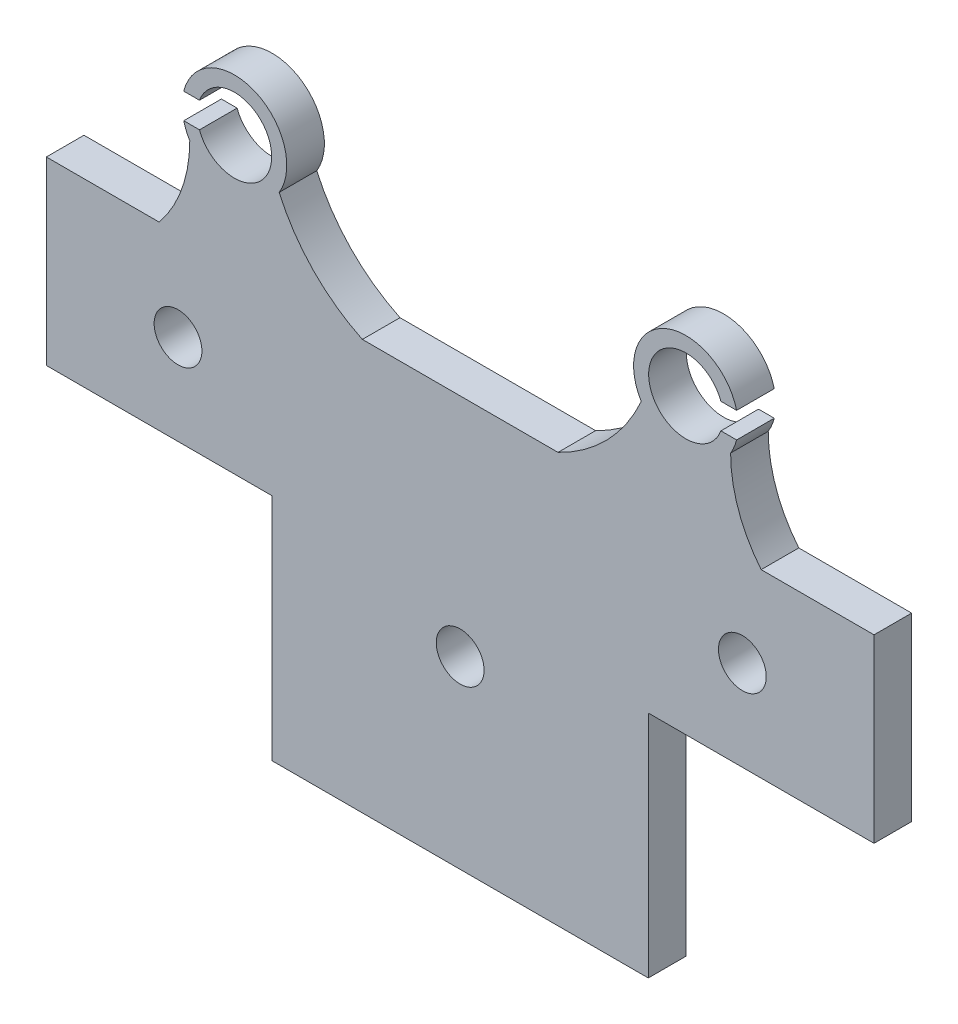
from build123d import *

# Parameters (mm, degrees)
CROQUIS1_R              = 4.95
CROQUIS1_R_2            = 3.175
SALIENTE_EXTRUIR1_DEPTH = 5
CORTAR_EXTRUIR1_DEPTH   = 78.590270009


with BuildPart() as part:
    # Croquis1 → Saliente-Extruir1 (new body)
    with BuildSketch(Plane.XY):
        with BuildLine():
            Line((13, 0), (-13, 0))
            ThreePointArc((-13, 0), (-19.544656296, 4.709966775), (-24.061489507, 11.389377737))
            ThreePointArc((-24.061489507, 11.389377737), (-30, 21.95), (-35.938510493, 11.389377737))
            ThreePointArc((-35.938510493, 11.389377737), (-36.984260452, 5.34343649), (-40, 0))
            Line((-40, 0), (-55, 0))
            Line((-55, 0), (-55, -24))
            Line((-55, -24), (-25, -24))
            Line((-25, -24), (-25, -54.5))
            Line((-25, -54.5), (25, -54.5))
            Line((25, -54.5), (25, -24))
            Line((25, -24), (55, -24))
            Line((55, -24), (55, 0))
            Line((55, 0), (40, 0))
            ThreePointArc((40, 0), (36.984260452, 5.34343649), (35.938510493, 11.389377737))
            ThreePointArc((35.938510493, 11.389377737), (30, 21.95), (24.061489507, 11.389377737))
            ThreePointArc((24.061489507, 11.389377737), (19.544656296, 4.709966775), (13, 0))
        make_face()
        with Locations((-30, 15)):
            Circle(CROQUIS1_R, mode=Mode.SUBTRACT)
        with Locations((-37.5, -12)):
            Circle(CROQUIS1_R_2, mode=Mode.SUBTRACT)
        with Locations((0, -30)):
            Circle(CROQUIS1_R_2, mode=Mode.SUBTRACT)
        with Locations(Location((30, 15, 0), (0, 0, 180))):
            Circle(CROQUIS1_R, mode=Mode.SUBTRACT)
        with Locations(Location((37.5, -12, 0), (0, 0, 180))):
            Circle(CROQUIS1_R_2, mode=Mode.SUBTRACT)
    extrude(amount=SALIENTE_EXTRUIR1_DEPTH)

    # Croquis2 → Cortar-Extruir1 (cut, through all)
    with BuildSketch(Plane.XY):
        with BuildLine():
            Line((-30, 16.7), (-36.738879729, 16.7))
            ThreePointArc((-36.738879729, 16.7), (-36.95, 15), (-36.738879729, 13.3))
            Line((-36.738879729, 13.3), (-30, 13.3))
            Line((-30, 13.3), (-30, 16.7))
        make_face()
        with BuildLine():
            Line((30, 16.7), (30, 13.3))
            Line((30, 13.3), (36.738879729, 13.3))
            ThreePointArc((36.738879729, 13.3), (36.95, 15), (36.738879729, 16.7))
            Line((36.738879729, 16.7), (30, 16.7))
        make_face()
    extrude(amount=CORTAR_EXTRUIR1_DEPTH, mode=Mode.SUBTRACT)


solid = part.part
